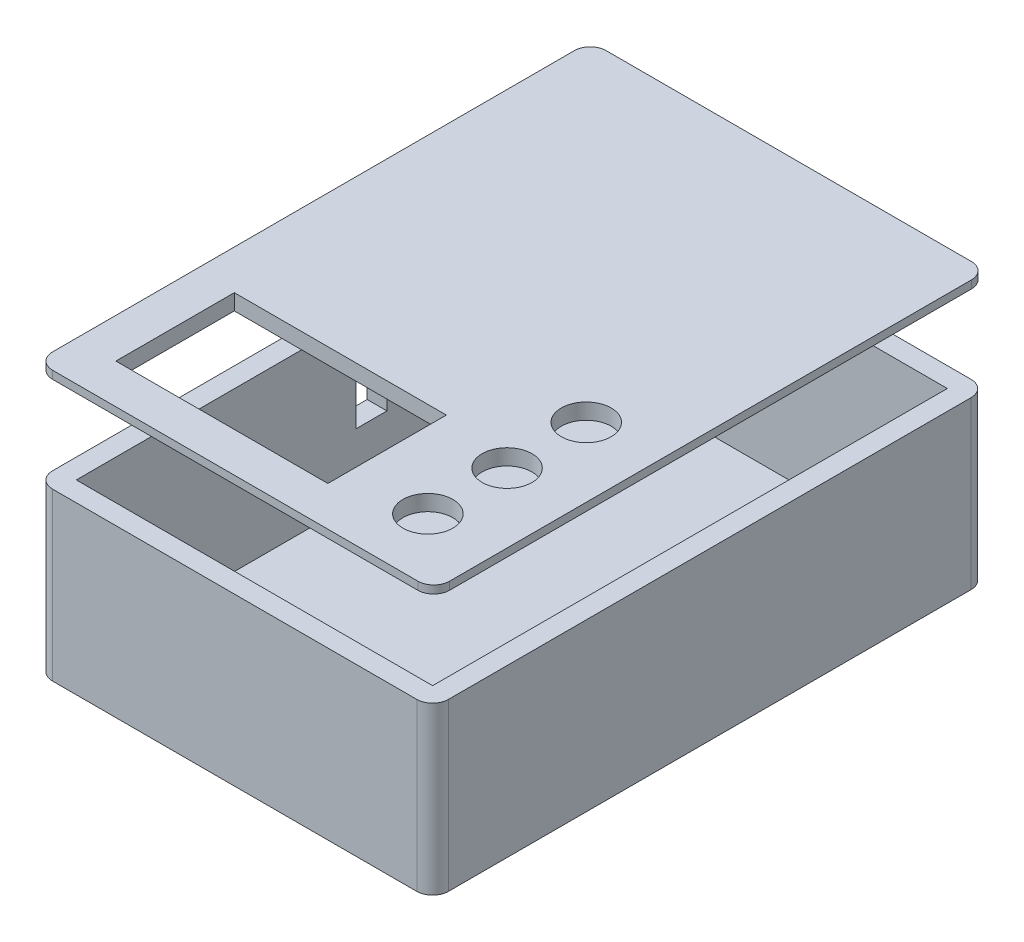
from build123d import *

# Parameters (mm, degrees)
SKETCH1_W           = 127
SKETCH1_H           = 177.8
BOSS_EXTRUDE1_DEPTH = 50.8
SKETCH2_W           = 114.3
SKETCH2_H           = 165.1
CUT_EXTRUDE1_DEPTH  = 50.8
SKETCH4_W           = 127
SKETCH4_H           = 177.8
BOSS_EXTRUDE2_DEPTH = 2.54
SKETCH5_W           = 106.68
SKETCH5_H           = 157.48
BOSS_EXTRUDE3_DEPTH = 2.54
SKETCH6_W           = 127.36100261
SKETCH6_H           = 177.565468033
BOSS_EXTRUDE4_DEPTH = 2.54
SKETCH7_R           = 8
SKETCH7_W           = 68
SKETCH7_H           = 38
CUT_EXTRUDE2_DEPTH  = 7.62
FILLET1_R           = 5.08
FILLET2_R           = 5.08
FILLET3_R           = 5.08
FILLET4_R           = 5.08
FILLET5_R           = 5.08
FILLET6_R           = 5.08
FILLET7_R           = 5.08
FILLET8_R           = 5.08
CUT_EXTRUDE3_DEPTH  = 5.08
CUT_EXTRUDE5_DEPTH  = 10.16
SKETCH10_3_W        = 10
SKETCH10_3_H        = 16
CUT_EXTRUDE6_DEPTH  = 10.16
SKETCH12_R          = 3.716498952
SKETCH12_R_2        = 2.42212238
SKETCH12_R_3        = 3.81
SKETCH12_R_4        = 2.54
BOSS_EXTRUDE5_DEPTH = 7.62
CUT_EXTRUDE7_START  = -2.54
SKETCH14_R          = 2.42212238
CUT_EXTRUDE7_DEPTH  = 2.54
CUT_EXTRUDE8_START  = -2.54
SKETCH15_R          = 2.54
CUT_EXTRUDE8_DEPTH  = 2.54
CUT_EXTRUDE9_START  = -2.54
SKETCH16_R          = 2.54
CUT_EXTRUDE9_DEPTH  = 2.54
CUT_EXTRUDE10_START = -2.54
SKETCH17_R          = 2.54
CUT_EXTRUDE10_DEPTH = 2.54


with BuildPart() as part:
    # Sketch1 → Boss-Extrude1 (new body)
    with BuildSketch(Plane(origin=(0, 0, 0), x_dir=(1, 0, 0), z_dir=(0, 1, 0))):
        with Locations((63.5, 88.9)):
            Rectangle(SKETCH1_W, SKETCH1_H)
    extrude(amount=BOSS_EXTRUDE1_DEPTH)

    # Sketch2 → Cut-Extrude1 (cut)
    with BuildSketch(Plane(origin=(0, 50.8, 0), x_dir=(1, 0, 0), z_dir=(0, 1, 0))):
        with Locations((63.5, 88.9)):
            Rectangle(SKETCH2_W, SKETCH2_H)
    extrude(amount=-CUT_EXTRUDE1_DEPTH, mode=Mode.SUBTRACT)

    # Sketch4 → Boss-Extrude2 (add)
    with BuildSketch(Plane(origin=(0, 0, 0), x_dir=(-1, 0, 0), z_dir=(0, -1, 0))):
        with Locations((-63.5, 88.9)):
            Rectangle(SKETCH4_W, SKETCH4_H)
    extrude(amount=BOSS_EXTRUDE2_DEPTH)

    # Fillet1
    fillet1_edges = [part.edges().sort_by_distance(p)[0] for p in [
        (127, 24.13, 0),
    ]]
    fillet(fillet1_edges, radius=FILLET1_R)

    # Fillet3
    fillet3_edges = [part.edges().sort_by_distance(p)[0] for p in [
        (127, 24.13, -177.8),
    ]]
    fillet(fillet3_edges, radius=FILLET3_R)

    # Fillet4
    fillet4_edges = [part.edges().sort_by_distance(p)[0] for p in [
        (0, 24.13, -177.8),
    ]]
    fillet(fillet4_edges, radius=FILLET4_R)

    # Fillet5
    fillet5_edges = [part.edges().sort_by_distance(p)[0] for p in [
        (0, 24.13, 0),
    ]]
    fillet(fillet5_edges, radius=FILLET5_R)

    # Sketch9 → Cut-Extrude3 (cut)
    with BuildSketch(Plane(origin=(0, 0, -177.8), x_dir=(-1, 0, 0), z_dir=(0, 0, -1))):
        with BuildLine():
            Line((-50.844364587, 32.954781393), (-76.2, 32.954781393))
            ThreePointArc((-76.2, 32.954781393), (-81.345218607, 38.1), (-76.2, 43.245218607))
            Line((-76.2, 43.245218607), (-50.844364587, 43.245218607))
            ThreePointArc((-50.844364587, 43.245218607), (-45.69914598, 38.1), (-50.844364587, 32.954781393))
        make_face()
    extrude(amount=-CUT_EXTRUDE3_DEPTH, mode=Mode.SUBTRACT)

    # Sketch10 → Cut-Extrude5 (cut)
    with BuildSketch(Plane.ZY):
        Polygon((-144.874057785, 20.146804291), (-152.874057785, 20.146804291), (-152.874057785, 36.146804291), (-142.874057785, 36.146804291), (-142.874057785, 20.146804291), align=None)
    extrude(amount=-CUT_EXTRUDE5_DEPTH, mode=Mode.SUBTRACT)

    # Sketch10<3> → Cut-Extrude6 (cut)
    with BuildSketch(Plane.ZY):
        with Locations((-132.174057785, 28.146804291)):
            Rectangle(SKETCH10_3_W, SKETCH10_3_H)
        with Locations((-116.586057785, 28.146804291)):
            Rectangle(SKETCH10_3_W, SKETCH10_3_H)
        with Locations((-100.998057785, 28.146804291)):
            Rectangle(SKETCH10_3_W, SKETCH10_3_H)
    extrude(amount=-CUT_EXTRUDE6_DEPTH, mode=Mode.SUBTRACT)

    # Sketch12 → Boss-Extrude5 (add)
    # profile 1 of 4: a face of its own
    with BuildSketch(Plane(origin=(0, 0, 0), x_dir=(1, 0, 0), z_dir=(0, 1, 0))):
        with Locations((114.3, 95.25)):
            Circle(SKETCH12_R)
        with Locations((114.3, 95.25)):
            Circle(SKETCH12_R_2, mode=Mode.SUBTRACT)
    # profile 2 of 4: a face of its own
    with BuildSketch(Plane(origin=(0, 0, 0), x_dir=(1, 0, 0), z_dir=(0, 1, 0))):
        with Locations((12.7, 95.25)):
            Circle(SKETCH12_R_3)
        with Locations((12.7, 95.25)):
            Circle(SKETCH12_R_4, mode=Mode.SUBTRACT)
    # profile 3 of 4: a face of its own
    with BuildSketch(Plane(origin=(0, 0, 0), x_dir=(1, 0, 0), z_dir=(0, 1, 0))):
        with Locations((12.7, 165.1)):
            Circle(SKETCH12_R_3)
        with Locations((12.7, 165.1)):
            Circle(SKETCH12_R_4, mode=Mode.SUBTRACT)
    # profile 4 of 4: a face of its own
    with BuildSketch(Plane(origin=(0, 0, 0), x_dir=(1, 0, 0), z_dir=(0, 1, 0))):
        with Locations((114.3, 165.1)):
            Circle(SKETCH12_R_3)
        with Locations((114.3, 165.1)):
            Circle(SKETCH12_R_4, mode=Mode.SUBTRACT)
    extrude(amount=BOSS_EXTRUDE5_DEPTH)

    # Sketch14 → Cut-Extrude7 (cut)
    with BuildSketch(Plane(origin=(0, 0, 0), x_dir=(1, 0, 0), z_dir=(0, 1, 0)).offset(CUT_EXTRUDE7_START)):
        with Locations((114.3, 95.25)):
            Circle(SKETCH14_R)
    extrude(amount=CUT_EXTRUDE7_DEPTH, mode=Mode.SUBTRACT)

    # Sketch15 → Cut-Extrude8 (cut)
    with BuildSketch(Plane(origin=(0, 0, 0), x_dir=(1, 0, 0), z_dir=(0, 1, 0)).offset(CUT_EXTRUDE8_START)):
        with Locations((114.3, 165.1)):
            Circle(SKETCH15_R)
    extrude(amount=CUT_EXTRUDE8_DEPTH, mode=Mode.SUBTRACT)

    # Sketch16 → Cut-Extrude9 (cut)
    with BuildSketch(Plane(origin=(0, 0, 0), x_dir=(1, 0, 0), z_dir=(0, 1, 0)).offset(CUT_EXTRUDE9_START)):
        with Locations((12.7, 165.1)):
            Circle(SKETCH16_R)
    extrude(amount=CUT_EXTRUDE9_DEPTH, mode=Mode.SUBTRACT)

    # Sketch17 → Cut-Extrude10 (cut)
    with BuildSketch(Plane(origin=(0, 0, 0), x_dir=(1, 0, 0), z_dir=(0, 1, 0)).offset(CUT_EXTRUDE10_START)):
        with Locations((12.7, 95.25)):
            Circle(SKETCH17_R)
    extrude(amount=CUT_EXTRUDE10_DEPTH, mode=Mode.SUBTRACT)


with BuildPart() as body_2:
    # Sketch5 → Boss-Extrude3 (new body)
    with BuildSketch(Plane(origin=(0, 78.74, 0), x_dir=(1, 0, 0), z_dir=(0, 1, 0))):
        with Locations((63.5, 88.9)):
            Rectangle(SKETCH5_W, SKETCH5_H)
    extrude(amount=BOSS_EXTRUDE3_DEPTH)

    # Sketch6 → Boss-Extrude4 (add)
    with BuildSketch(Plane(origin=(0, 81.28, 0), x_dir=(1, 0, 0), z_dir=(0, 1, 0))):
        with Locations((63.680501305, 88.782734017)):
            Rectangle(SKETCH6_W, SKETCH6_H)
    extrude(amount=BOSS_EXTRUDE4_DEPTH)

    # Sketch7 → Cut-Extrude2 (cut)
    with BuildSketch(Plane(origin=(0, 83.82, 0), x_dir=(1, 0, 0), z_dir=(0, 1, 0))):
        with Locations((105.161265821, 20.32)):
            Circle(SKETCH7_R)
        with Locations((105.161265821, 45.72)):
            Circle(SKETCH7_R)
        with Locations((105.161265821, 71.12)):
            Circle(SKETCH7_R)
        with Locations((46.7, 31.7)):
            Rectangle(SKETCH7_W, SKETCH7_H)
    extrude(amount=-CUT_EXTRUDE2_DEPTH, mode=Mode.SUBTRACT)

    # Fillet2
    fillet2_edges = [body_2.edges().sort_by_distance(p)[0] for p in [
        (127.36100261, 82.55, 0),
    ]]
    fillet(fillet2_edges, radius=FILLET2_R)

    # Fillet6
    fillet6_edges = [body_2.edges().sort_by_distance(p)[0] for p in [
        (127.36100261, 82.55, -177.565468033),
    ]]
    fillet(fillet6_edges, radius=FILLET6_R)

    # Fillet7
    fillet7_edges = [body_2.edges().sort_by_distance(p)[0] for p in [
        (0, 82.55, -177.565468033),
    ]]
    fillet(fillet7_edges, radius=FILLET7_R)

    # Fillet8
    fillet8_edges = [body_2.edges().sort_by_distance(p)[0] for p in [
        (0, 82.55, 0),
    ]]
    fillet(fillet8_edges, radius=FILLET8_R)


solid = Compound([part.part, body_2.part])
